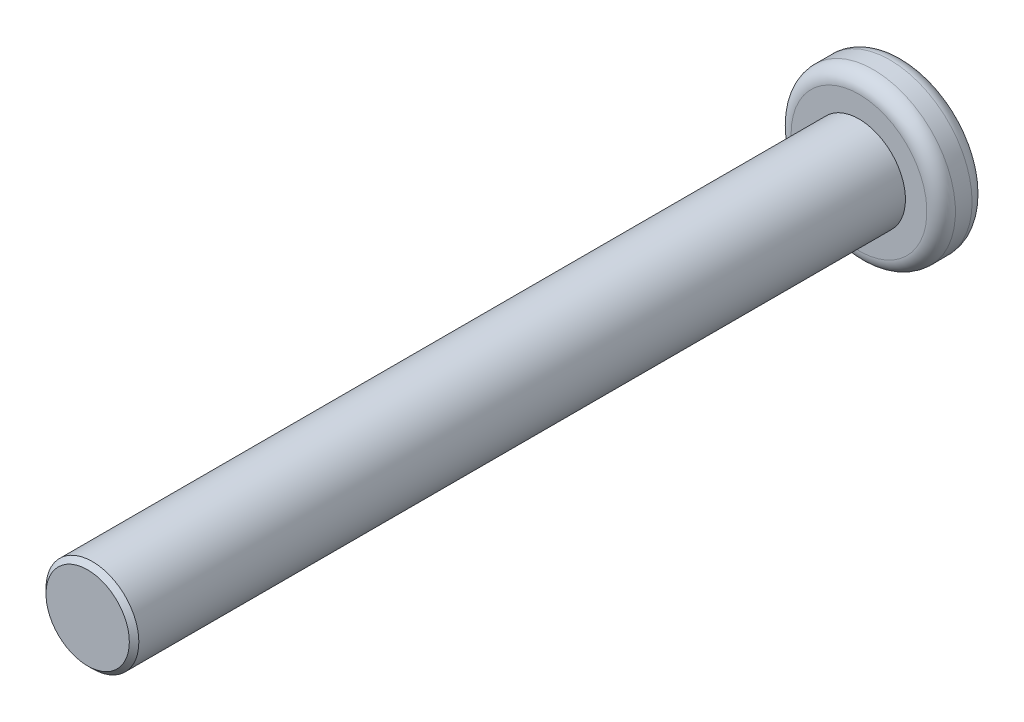
from build123d import *

# Parameters (mm, degrees)
ESQUISSE1_R        = 0.975
BOSS_EXTRU_1_DEPTH = 17.15
ESQUISSE2_R        = 1.725
BOSS_EXTRU_2_DEPTH = 0.95
CONG_1_R           = 0.3
CHANFREIN1_SIZE    = 0.1
SCALE1_SCALE       = 6.5


with BuildPart() as part:
    # Esquisse1 → Boss.-Extru.1 (new body)
    with BuildSketch(Plane.XY):
        Circle(ESQUISSE1_R)
    extrude(amount=BOSS_EXTRU_1_DEPTH)

    # Esquisse2 → Boss.-Extru.2 (add)
    with BuildSketch(Plane(origin=(0, 0, 0), x_dir=(-1, 0, 0), z_dir=(0, 0, -1))):
        Circle(ESQUISSE2_R)
    extrude(amount=-BOSS_EXTRU_2_DEPTH)

    # Congé1
    cong_1_edges = [part.edges().sort_by_distance(p)[0] for p in [
        (1.725, 0, 0),
        (1.725, 0, 0.95),
    ]]
    fillet(cong_1_edges, radius=CONG_1_R)

    # Chanfrein1
    chanfrein1_edges = [part.edges().sort_by_distance(p)[0] for p in [
        (-0.975, 0, 17.15),
    ]]
    chamfer(chanfrein1_edges, length=CHANFREIN1_SIZE)


with BuildPart() as part_1:
    # Scale1: scaled about (0, 0, 7.76650322)
    add(part.part.scale(SCALE1_SCALE).moved(Location((0, 0, -42.71576771))))


solid = part_1.part
